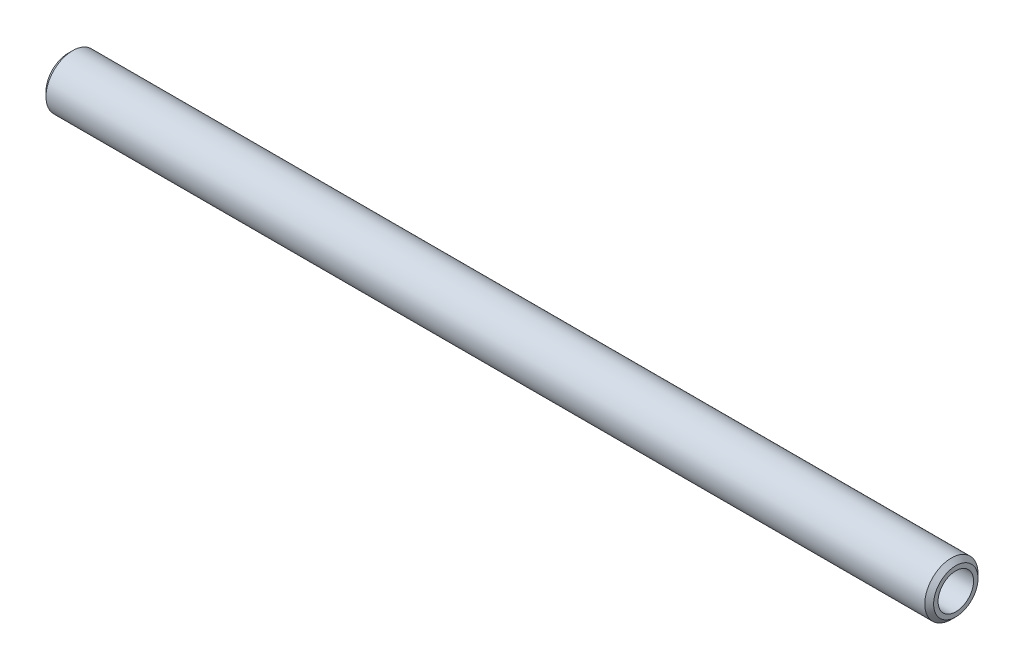
from build123d import *

# Parameters (mm, degrees)
ESQUISSE1_R        = 3
ESQUISSE1_R_2      = 2
BOSS_EXTRU_1_DEPTH = 50
CHANFREIN1_SIZE    = 0.5


with BuildPart() as part:
    # Esquisse1 → Boss.-Extru.1 (new, symmetric)
    with BuildSketch(Plane(origin=(0, 0, 0), x_dir=(0, 0, -1), z_dir=(1, 0, 0))):
        Circle(ESQUISSE1_R)
        Circle(ESQUISSE1_R_2, mode=Mode.SUBTRACT)
    extrude(amount=BOSS_EXTRU_1_DEPTH, both=True)

    # Chanfrein1
    chanfrein1_edges = [part.edges().sort_by_distance(p)[0] for p in [
        (-50, 0, 3),
        (50, 0, 3),
    ]]
    chamfer(chanfrein1_edges, length=CHANFREIN1_SIZE)


solid = part.part
